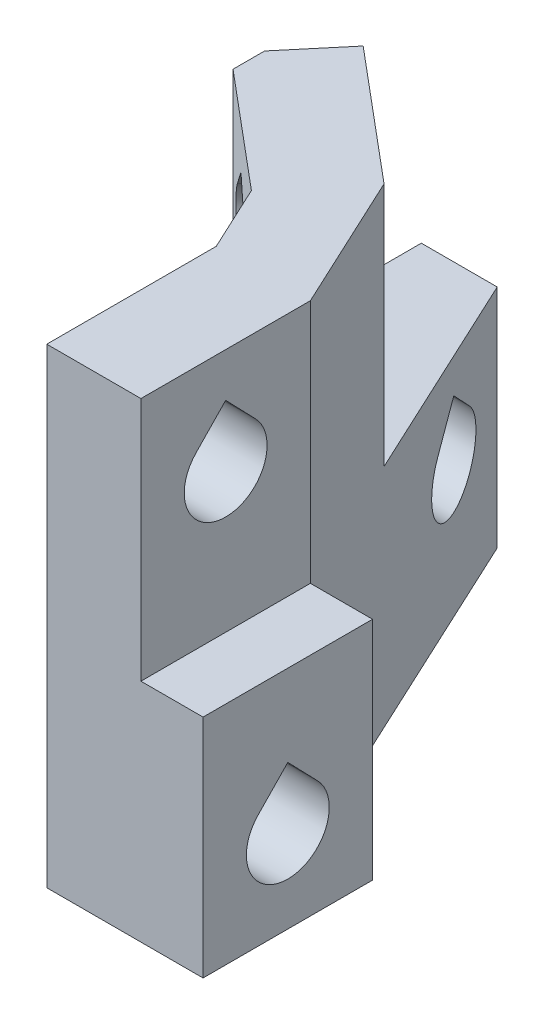
from build123d import *

# Parameters (mm, degrees)
BOSS_EXTRUDE1_DEPTH = 12
BOSS_EXTRUDE2_DEPTH = 13
SKETCH3_W           = 9
SKETCH3_H           = 12
BOSS_EXTRUDE3_DEPTH = 3.3
CUT_EXTRUDE1_DEPTH  = 34.256578297
CUT_EXTRUDE2_DEPTH  = 25.143114961
CUT_EXTRUDE3_DEPTH  = 25.143114961
CUT_EXTRUDE4_DEPTH  = 28.6007146
CUT_EXTRUDE5_DEPTH  = 28.748873851
CHAMFER1_SIZE       = 2.129646437


with BuildPart() as part:
    # Sketch1 → Boss-Extrude1 (new body)
    with BuildSketch(Plane.XZ.offset(17)):
        Polygon((-11.968992121, -12.590713597), (-3.3, 6), (-3.3, 15), (-16, 15), (-16, -12.590713597), align=None)
    extrude(amount=-BOSS_EXTRUDE1_DEPTH)

    # Sketch2 → Boss-Extrude2 (add)
    with BuildSketch(Plane(origin=(0, -5, 0), x_dir=(-1, 0, 0), z_dir=(0, 1, 0))):
        Polygon((16, 15), (16, -4.267799921), (13.611865759, -7.113867483), (6.717465771, -1.328778996), (3.3, 6), (3.3, 15), align=None)
    extrude(amount=BOSS_EXTRUDE2_DEPTH)

    # Sketch3 → Boss-Extrude3 (add)
    with BuildSketch(Plane(origin=(-3.3, 0, 0), x_dir=(0, 0, -1), z_dir=(1, 0, 0))):
        with Locations((-10.5, -11)):
            Rectangle(SKETCH3_W, SKETCH3_H)
    extrude(amount=BOSS_EXTRUDE3_DEPTH)

    # Sketch4 → Cut-Extrude1 (cut, through all)
    with BuildSketch(Plane.XZ.offset(17)):
        Polygon((-16, -2.590713597), (-8.3, 3.870353563), (-8.3, 15), (-16, 15), align=None)
    extrude(amount=-CUT_EXTRUDE1_DEPTH, mode=Mode.SUBTRACT)

    # Sketch5 → Cut-Extrude2 (cut, through all)
    with BuildSketch(Plane.ZY.offset(8.3)):
        with BuildLine():
            Line((10.5, -9.332975613), (8.917452439, -10.971751585))
            ThreePointArc((8.917452439, -10.971751585), (10.5, -14.7), (12.082547561, -10.971751585))
            Line((12.082547561, -10.971751585), (10.5, -9.332975613))
        make_face()
    extrude(amount=-CUT_EXTRUDE2_DEPTH, mode=Mode.SUBTRACT)

    # Sketch6 → Cut-Extrude3 (cut, through all)
    with BuildSketch(Plane.ZY.offset(8.3)):
        with BuildLine():
            Line((10.5, 5.667024387), (8.917452439, 4.028248415))
            ThreePointArc((8.917452439, 4.028248415), (10.5, 0.3), (12.082547561, 4.028248415))
            Line((12.082547561, 4.028248415), (10.5, 5.667024387))
        make_face()
    extrude(amount=-CUT_EXTRUDE3_DEPTH, mode=Mode.SUBTRACT)

    # Sketch7 → Cut-Extrude4 (cut, through all)
    with BuildSketch(Plane(origin=(-5.33513716, 0, 6.358168878), x_dir=(0.766044443118978, 0, 0.6427876096865394), z_dir=(-0.6427876096865394, 0, 0.766044443118978))):
        with BuildLine():
            Line((-10.500035221, 5.667024387), (-12.082582782, 4.028248415))
            ThreePointArc((-12.082582782, 4.028248415), (-10.500035221, 0.3), (-8.91748766, 4.028248415))
            Line((-8.91748766, 4.028248415), (-10.500035221, 5.667024387))
        make_face()
    extrude(amount=-CUT_EXTRUDE4_DEPTH, mode=Mode.SUBTRACT)

    # Sketch8 → Cut-Extrude5 (cut, through all)
    with BuildSketch(Plane.ZY.offset(16)):
        with BuildLine():
            Line((-8.26977078, -6.832975613), (-9.852318341, -8.471751585))
            ThreePointArc((-9.852318341, -8.471751585), (-8.26977078, -12.2), (-6.68722322, -8.471751585))
            Line((-6.68722322, -8.471751585), (-8.26977078, -6.832975613))
        make_face()
    extrude(amount=-CUT_EXTRUDE5_DEPTH, mode=Mode.SUBTRACT)

    # Chamfer1
    chamfer1_edges = [part.edges().sort_by_distance(p)[0] for p in [
        (-8.3, -4.5, 3.870353563),
    ]]
    chamfer(chamfer1_edges, length=CHAMFER1_SIZE)


solid = part.part
